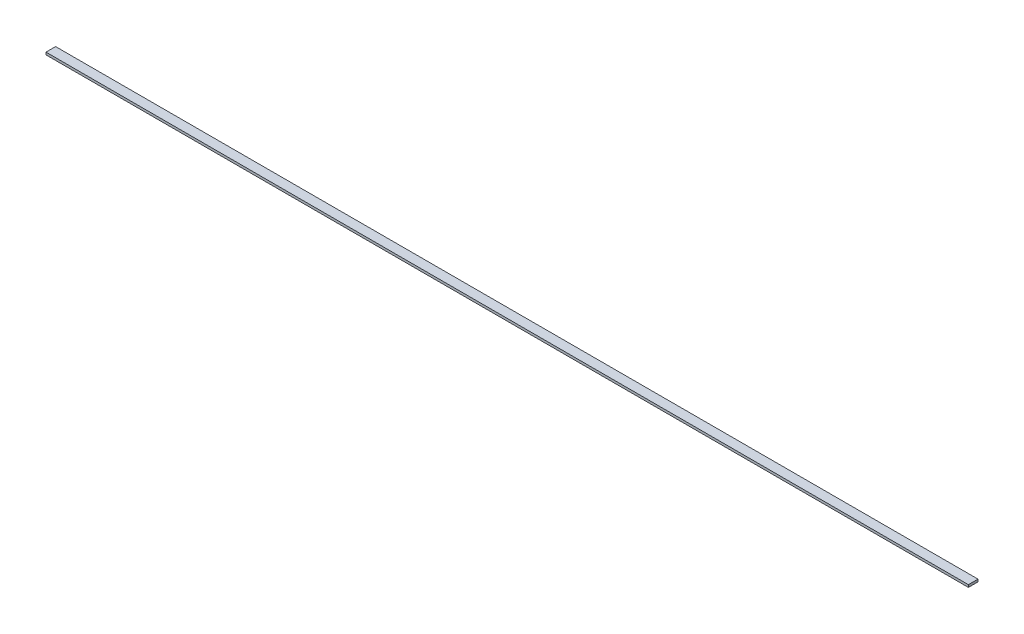
from build123d import *

# Parameters (mm, degrees)
SKETCH1_W           = 2438.4
SKETCH1_H           = 25.4
BOSS_EXTRUDE1_DEPTH = 6.35


with BuildPart() as part:
    # Sketch1 → Boss-Extrude1 (new body)
    with BuildSketch(Plane(origin=(0, 0, 0), x_dir=(1, 0, 0), z_dir=(0, 1, 0))):
        Rectangle(SKETCH1_W, SKETCH1_H)
    extrude(amount=BOSS_EXTRUDE1_DEPTH)


solid = part.part
